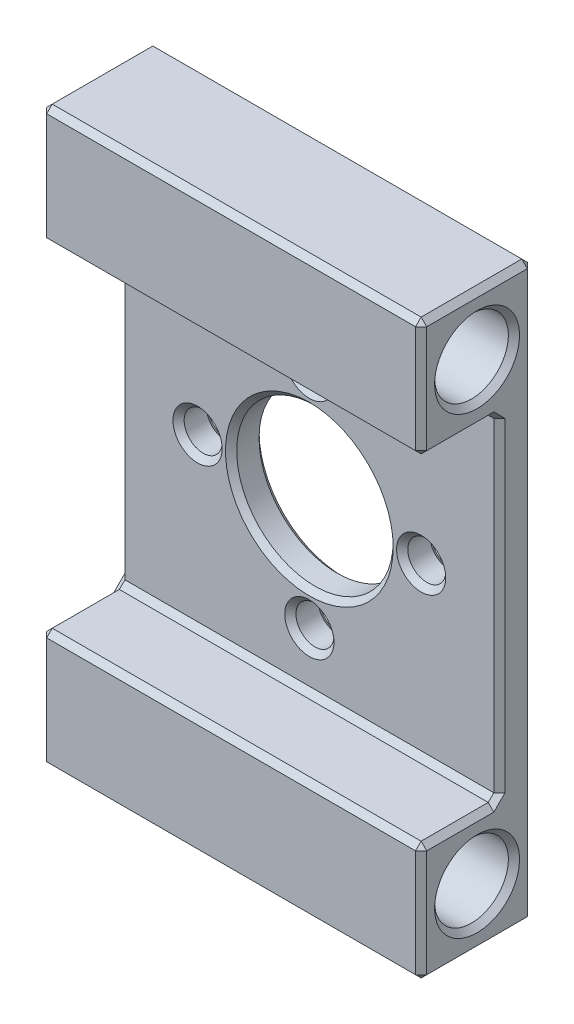
from build123d import *

# Parameters (mm, degrees)
ESQUISSE1_W             = 34
ESQUISSE1_H             = 51.2
BOSS_EXTRU_1_DEPTH      = 10
ESQUISSE4_W             = 34
ESQUISSE4_H             = 30
ENL_V_MAT_EXTRU_1_DEPTH = 7
ESQUISSE5_R             = 7
ENL_V_MAT_EXTRU_2_DEPTH = 62.858224999
D_GAGEMENT_M62_D        = 6.6
D_GAGEMENT_M31_D        = 3.4
CHANFREIN1_SIZE         = 0.5


with BuildPart() as part:
    # Esquisse1 → Boss.-Extru.1 (new body)
    with BuildSketch(Plane.XY):
        with Locations((17, 25.6)):
            Rectangle(ESQUISSE1_W, ESQUISSE1_H)
    extrude(amount=BOSS_EXTRU_1_DEPTH)

    # Esquisse4 → Enlèv. mat.-Extru.1 (cut)
    with BuildSketch(Plane.XY.offset(10)):
        with Locations((17, 25.6)):
            Rectangle(ESQUISSE4_W, ESQUISSE4_H)
    extrude(amount=-ENL_V_MAT_EXTRU_1_DEPTH, mode=Mode.SUBTRACT)

    # Esquisse5 → Enlèv. mat.-Extru.2 (cut, through all)
    with BuildSketch(Plane.XY.offset(3)):
        with Locations((17, 25.6)):
            Circle(ESQUISSE5_R)
    extrude(amount=-ENL_V_MAT_EXTRU_2_DEPTH, mode=Mode.SUBTRACT)

    # Dégagement M62 (through all)
    with Locations(Plane.ZY):
        with Locations((5, 45.9), (5, 5.3)):
            Hole(D_GAGEMENT_M62_D / 2)

    # Dégagement M31 (through all)
    with Locations(Plane.XY.offset(3)):
        with Locations((17, 35.6), (7, 25.6), (17, 15.6), (27, 25.6)):
            Hole(D_GAGEMENT_M31_D / 2)

    # Chanfrein1
    chanfrein1_edges = [part.edges().sort_by_distance(p)[0] for p in [
        (34, 5.3, 10),
        (17, 51.2, 10),
        (0, 5.3, 10),
        (34, 45.9, 10),
        (0, 25.6, 3),
        (0, 10.6, 6.5),
        (17, 40.6, 3),
        (0, 40.6, 6.5),
        (34, 25.6, 3),
        (34, 40.6, 6.5),
        (17, 10.6, 3),
        (34, 10.6, 6.5),
        (17, 10.6, 10),
        (17, 40.6, 10),
        (10, 25.6, 0),
        (10, 25.6, 3),
        (0, 5.3, 8.3),
        (34, 5.3, 8.3),
        (0, 45.9, 10),
        (0, 45.9, 8.3),
        (34, 45.9, 8.3),
        (17, 51.2, 0),
        (34, 25.6, 0),
        (28.7, 25.6, 3),
        (28.7, 25.6, 0),
        (17, 0, 0),
        (18.7, 15.6, 3),
        (18.7, 15.6, 0),
        (0, 25.6, 0),
        (8.7, 25.6, 3),
        (8.7, 25.6, 0),
        (18.7, 35.6, 3),
        (18.7, 35.6, 0),
        (17, 0, 10),
        (0, 51.2, 5),
        (34, 51.2, 5),
        (34, 0, 5),
        (0, 0, 5),
    ]]
    chamfer(chanfrein1_edges, length=CHANFREIN1_SIZE)


solid = part.part
